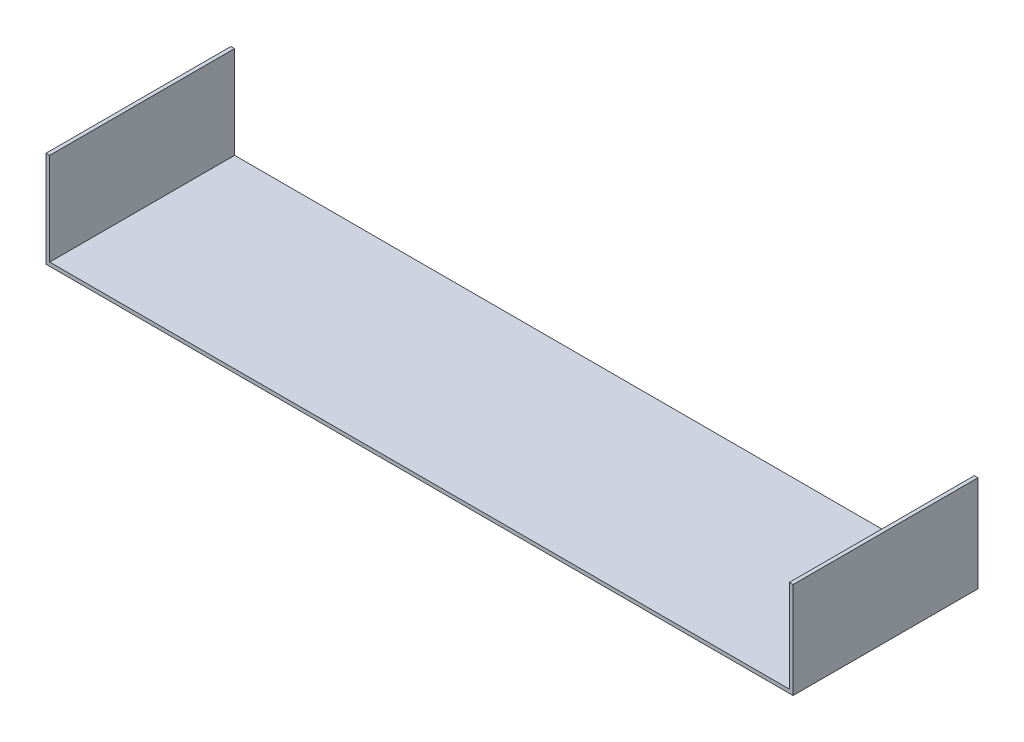
from build123d import *

# Parameters (mm, degrees)
BOSS_EXTRUDE1_DEPTH = 10000


with BuildPart() as part:
    # Sketch2 → Boss-Extrude1 (new body)
    with BuildSketch(Plane.XY):
        Polygon((0, 0), (0, -5000), (40000, -5000), (40000, 0), (40200, 0), (40200, -5200), (-200, -5200), (-200, 0), align=None)
    extrude(amount=-BOSS_EXTRUDE1_DEPTH)


solid = part.part
